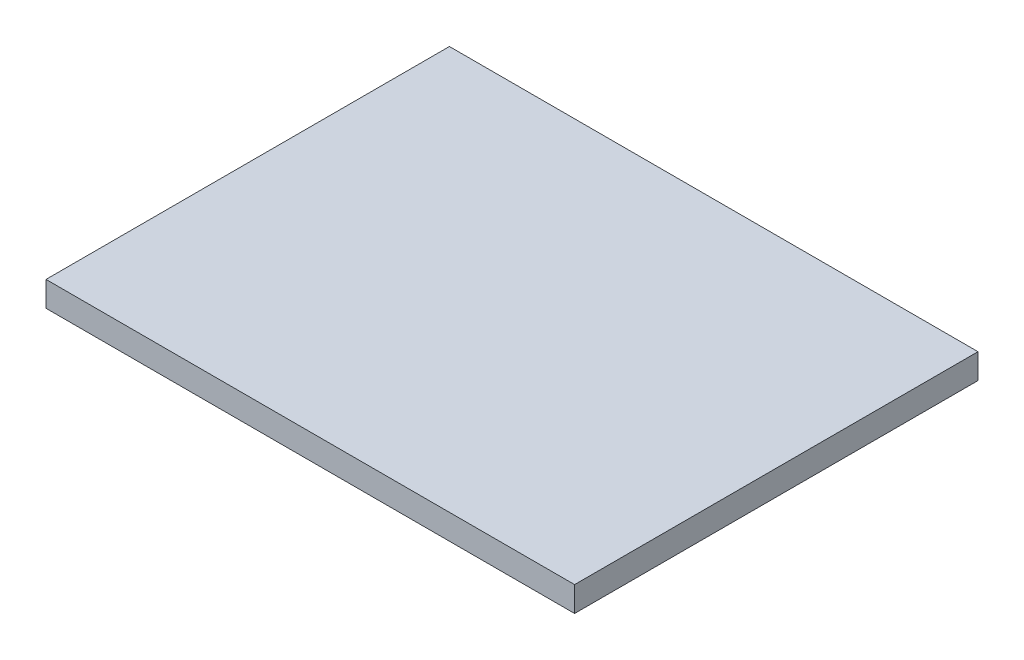
from build123d import *

# Parameters (mm, degrees)
SKETCH1_W           = 380
SKETCH1_H           = 290
BOSS_EXTRUDE1_DEPTH = 18


with BuildPart() as part:
    # Sketch1 → Boss-Extrude1 (new body)
    with BuildSketch(Plane(origin=(0, 0, 0), x_dir=(1, 0, 0), z_dir=(0, 1, 0))):
        Rectangle(SKETCH1_W, SKETCH1_H)
    extrude(amount=BOSS_EXTRUDE1_DEPTH)


solid = part.part
